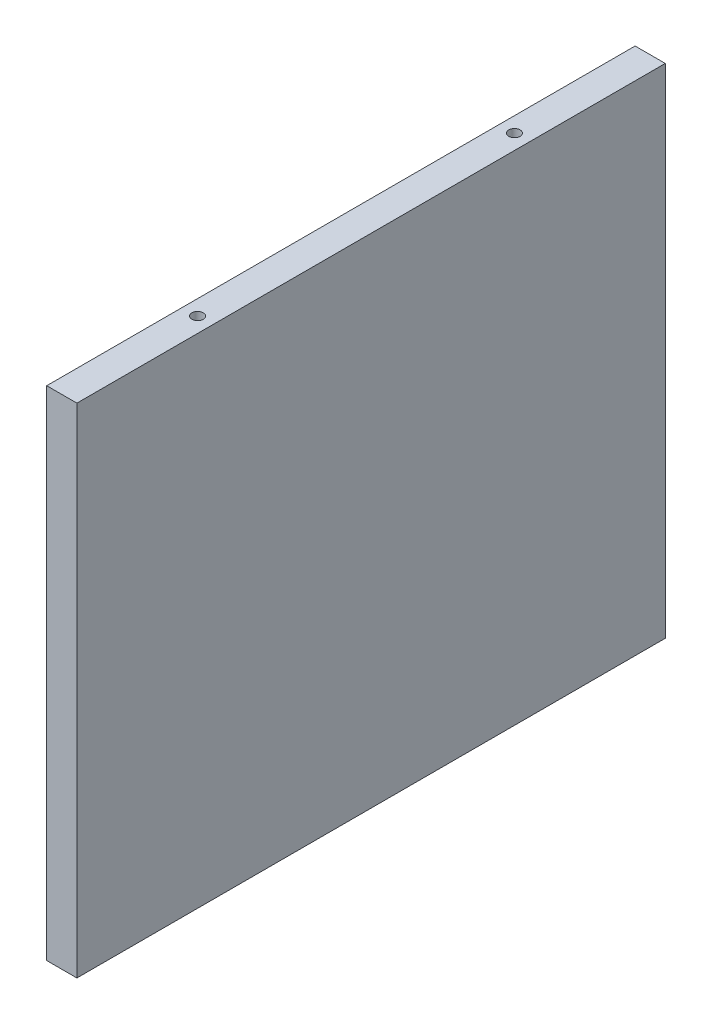
from build123d import *

# Parameters (mm, degrees)
ESQUISSE1_W             = 20
ESQUISSE1_H             = 390
BOSS_EXTRU_1_DEPTH      = 330
ESQUISSE2_R             = 3.75
ENL_V_MAT_EXTRU_1_DEPTH = 10
ENL_V_START             = -10
ESQUISSE3_R             = 3.75
ENL_V_MAT_EXTRU_2_DEPTH = 10


with BuildPart() as part:
    # Esquisse1 → Boss.-Extru.1 (new body)
    with BuildSketch(Plane(origin=(0, 0, 0), x_dir=(1, 0, 0), z_dir=(0, 1, 0))):
        Rectangle(ESQUISSE1_W, ESQUISSE1_H)
    extrude(amount=BOSS_EXTRU_1_DEPTH)

    # Esquisse2 → Enlèv. mat.-Extru.1 (cut)
    with BuildSketch(Plane(origin=(0, 330, 0), x_dir=(1, 0, 0), z_dir=(0, 1, 0))):
        with Locations(Location((0, 105, 0), (0, 0, 270))):
            Circle(ESQUISSE2_R)
        with Locations(Location((0, -105, 0), (0, 0, 270))):
            Circle(ESQUISSE2_R)
    extrude(amount=-ENL_V_MAT_EXTRU_1_DEPTH, mode=Mode.SUBTRACT)

    # Esquisse3 → Enlèv. mat.-Extru.2 (cut)
    with BuildSketch(Plane.XZ.offset(ENL_V_START)):
        with Locations(Location((0, -105, 0), (0, 0, 90))):
            Circle(ESQUISSE3_R)
        with Locations(Location((0, 105, 0), (0, 0, 90))):
            Circle(ESQUISSE3_R)
    extrude(amount=ENL_V_MAT_EXTRU_2_DEPTH, mode=Mode.SUBTRACT)


solid = part.part
